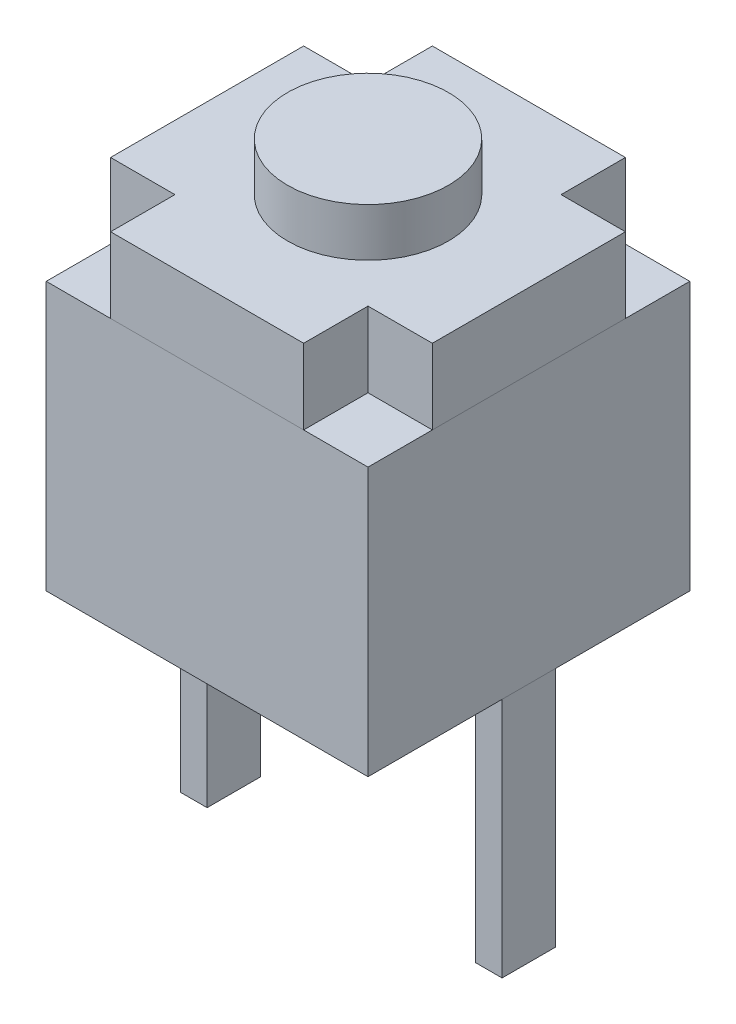
from build123d import *

# Parameters (mm, degrees)
SKETCH_1_W        = 6
SKETCH_1_H        = 6
EXTRUDE_1_DEPTH   = 5
EXTRUDE_2_DEPTH   = 1.4
SKETCH_4_R        = 1.5
EXTRUDE_3_DEPTH   = 0.9
SKETCH_5_W        = 0.5
SKETCH_5_H        = 1
EXTRUDE_4_DEPTH   = 4.5
EXTRUDE_4_2_DEPTH = 4.5


with BuildPart() as part:
    # 草图1 → 凸台-拉伸1 (new body)
    with BuildSketch(Plane(origin=(0, 0, 0), x_dir=(1, 0, 0), z_dir=(0, 1, 0))):
        Rectangle(SKETCH_1_W, SKETCH_1_H)
    extrude(amount=EXTRUDE_1_DEPTH)


with BuildPart() as body_2:
    # 草图3 → 凸台-拉伸2 (new body)
    with BuildSketch(Plane(origin=(0, 5, 0), x_dir=(1, 0, 0), z_dir=(0, 1, 0))):
        Polygon((1.8, 1.8), (1.8, 3), (-1.8, 3), (-1.8, 1.8), (-3, 1.8), (-3, -1.8), (-1.8, -1.8), (-1.8, -3), (1.8, -3), (1.8, -1.8), (3, -1.8), (3, 1.8), align=None)
    extrude(amount=EXTRUDE_2_DEPTH)


with BuildPart() as body_3:
    # 草图4 → 凸台-拉伸3 (new body)
    with BuildSketch(Plane(origin=(0, 6.4, 0), x_dir=(1, 0, 0), z_dir=(0, 1, 0))):
        with Locations(Location((0, 0, 0), (0, 0, 270))):
            Circle(SKETCH_4_R)
    extrude(amount=EXTRUDE_3_DEPTH)


with BuildPart() as body_4:
    # 草图5 → 凸台-拉伸4 (new body)
    with BuildSketch(Plane.XZ):
        with Locations((2.75, 0)):
            Rectangle(SKETCH_5_W, SKETCH_5_H)
    extrude(amount=EXTRUDE_4_DEPTH)


with BuildPart() as body_5:
    # 草图5 → Extrude 4 2 (new body)
    with BuildSketch(Plane.XZ):
        with Locations((-2.75, 0)):
            Rectangle(SKETCH_5_W, SKETCH_5_H)
    extrude(amount=EXTRUDE_4_2_DEPTH)


solid = Compound([part.part, body_2.part, body_3.part, body_4.part, body_5.part])
